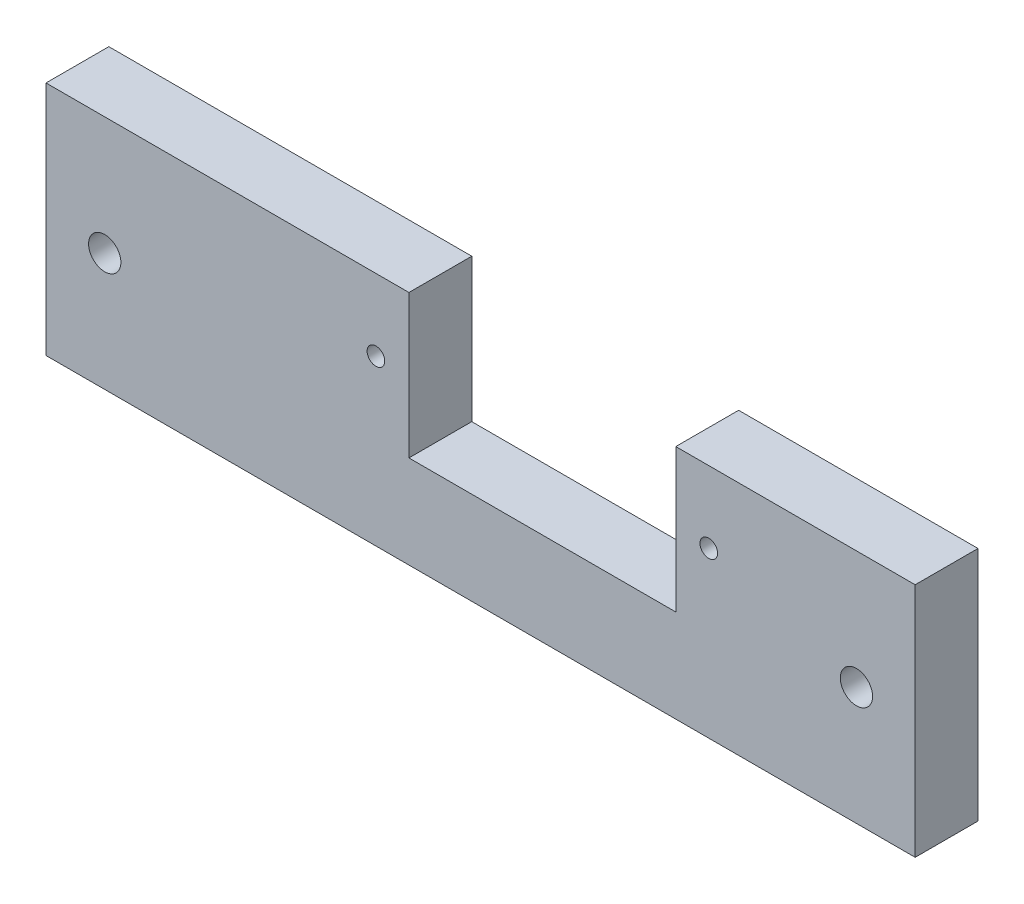
from build123d import *

# Parameters (mm, degrees)
MODEL_R             = 1.375
MODEL_R_2           = 0.75
BOSS_EXTRUDE1_DEPTH = 5.35


with BuildPart() as part:
    # Model → Boss-Extrude1 (new body)
    with BuildSketch(Plane.XY):
        Polygon((53.62, 20.1), (74, 20.1), (74, 0), (0, 0), (0, 20.1), (30.9, 20.1), (30.9, 7.9), (53.62, 7.9), align=None)
        with Locations((5, 10.05)):
            Circle(MODEL_R, mode=Mode.SUBTRACT)
        with Locations((56.43, 14)):
            Circle(MODEL_R_2, mode=Mode.SUBTRACT)
        with Locations((28.09, 14)):
            Circle(MODEL_R_2, mode=Mode.SUBTRACT)
        with Locations((69, 10.05)):
            Circle(MODEL_R, mode=Mode.SUBTRACT)
    extrude(amount=BOSS_EXTRUDE1_DEPTH)


solid = part.part
